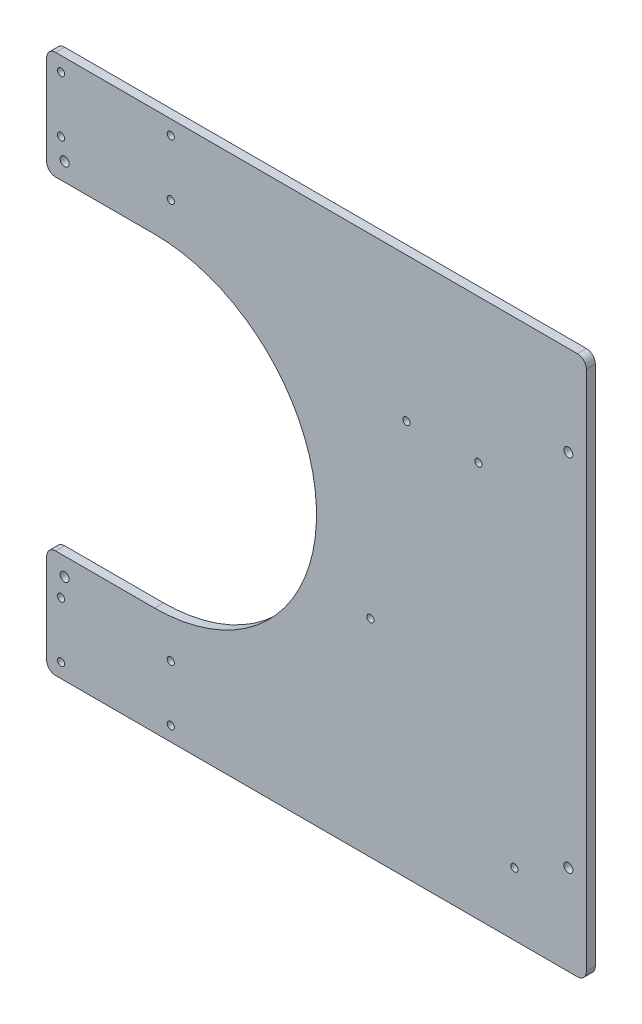
from build123d import *

# Parameters (mm, degrees)
SKETCH_1_R      = 2.5
SKETCH_1_R_2    = 2
EXTRUDE_1_DEPTH = 5


with BuildPart() as part:
    # 草图1 → 凸台-拉伸1 (new body)
    with BuildSketch(Plane.XY):
        with BuildLine():
            Line((5, 0), (295, 0))
            ThreePointArc((295, 0), (298.535533906, 1.464466094), (300, 5))
            Line((300, 5), (300, 295))
            ThreePointArc((300, 295), (298.535533906, 298.535533906), (295, 300))
            Line((295, 300), (5, 300))
            ThreePointArc((5, 300), (1.464466094, 298.535533906), (0, 295))
            Line((0, 295), (0, 245))
            ThreePointArc((0, 245), (1.464466094, 241.464466094), (5, 240))
            Line((5, 240), (60, 240))
            ThreePointArc((60, 240), (150, 150), (60, 60))
            Line((60, 60), (5, 60))
            ThreePointArc((5, 60), (1.464466094, 58.535533906), (0, 55))
            Line((0, 55), (0, 5))
            ThreePointArc((0, 5), (1.464466094, 1.464466094), (5, 0))
        make_face()
        with Locations((10, 250)):
            Circle(SKETCH_1_R, mode=Mode.SUBTRACT)
        with Locations(Location((290, 250, 0), (0, 0, 180))):
            Circle(SKETCH_1_R, mode=Mode.SUBTRACT)
        with Locations(Location((10, 50, 0), (0, 0, 180))):
            Circle(SKETCH_1_R, mode=Mode.SUBTRACT)
        with Locations((290, 50)):
            Circle(SKETCH_1_R, mode=Mode.SUBTRACT)
        with Locations((8, 292)):
            Circle(SKETCH_1_R_2, mode=Mode.SUBTRACT)
        with Locations((69, 292)):
            Circle(SKETCH_1_R_2, mode=Mode.SUBTRACT)
        with Locations((69, 261)):
            Circle(SKETCH_1_R_2, mode=Mode.SUBTRACT)
        with Locations((8, 261)):
            Circle(SKETCH_1_R_2, mode=Mode.SUBTRACT)
        with Locations(Location((8, 39, 0), (0, 0, 180))):
            Circle(SKETCH_1_R_2, mode=Mode.SUBTRACT)
        with Locations(Location((69, 39, 0), (0, 0, 180))):
            Circle(SKETCH_1_R_2, mode=Mode.SUBTRACT)
        with Locations(Location((69, 8, 0), (0, 0, 180))):
            Circle(SKETCH_1_R_2, mode=Mode.SUBTRACT)
        with Locations(Location((8, 8, 0), (0, 0, 180))):
            Circle(SKETCH_1_R_2, mode=Mode.SUBTRACT)
        with Locations((200, 220)):
            Circle(SKETCH_1_R_2, mode=Mode.SUBTRACT)
        with Locations((240, 220)):
            Circle(SKETCH_1_R_2, mode=Mode.SUBTRACT)
        with Locations((180, 115)):
            Circle(SKETCH_1_R_2, mode=Mode.SUBTRACT)
        with Locations((260, 35)):
            Circle(SKETCH_1_R_2, mode=Mode.SUBTRACT)
    extrude(amount=EXTRUDE_1_DEPTH)


solid = part.part
